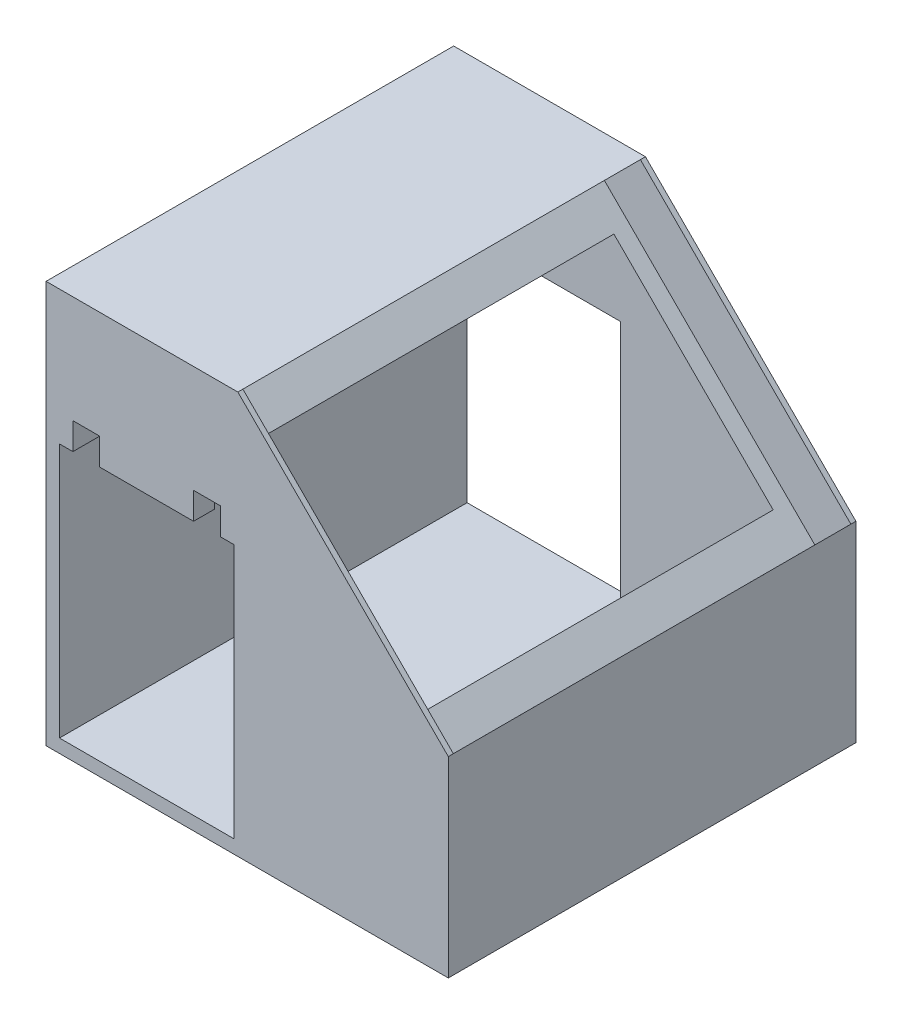
from build123d import *

# Parameters (mm, degrees)
SKETCH1_W           = 150
SKETCH1_H           = 150
SKETCH1_W_2         = 65
SKETCH1_H_2         = 95
BOSS_EXTRUDE2_DEPTH = 152
CHAMFER1_SIZE       = 78.48885271
SKETCH4_W           = 148.25
SKETCH4_H           = 111
CUT_EXTRUDE5_DEPTH  = 19
SKETCH5_W           = 136.25
SKETCH5_H           = 84
CUT_EXTRUDE6_DEPTH  = 81
SKETCH6_W           = 10
SKETCH6_H           = 10
CUT_EXTRUDE7_DEPTH  = 40
SKETCH7_W           = 10
SKETCH7_H           = 10
CUT_EXTRUDE8_DEPTH  = 40
SKETCH10_W          = 40
SKETCH10_H          = 6
CUT_EXTRUDE10_DEPTH = 10


with BuildPart() as part:
    # Sketch1 → Boss-Extrude2 (new body)
    with BuildSketch(Plane.XY):
        with Locations((75, 75)):
            Rectangle(SKETCH1_W, SKETCH1_H)
        with Locations((37.5, 52.5)):
            Rectangle(SKETCH1_W_2, SKETCH1_H_2, mode=Mode.SUBTRACT)
    extrude(amount=BOSS_EXTRUDE2_DEPTH)

    # Chamfer1
    chamfer1_edges = [part.edges().sort_by_distance(p)[0] for p in [
        (150, 150, 76),
    ]]
    chamfer(chamfer1_edges, length=CHAMFER1_SIZE)

    # Sketch4 → Cut-Extrude5 (cut)
    with BuildSketch(Plane(origin=(110.755573645, 110.755573645, 0), x_dir=(0, 0, -1), z_dir=(0.7071067811865489, 0.7071067811865461, 0))):
        with Locations((-76, 0.001948307)):
            Rectangle(SKETCH4_W, SKETCH4_H)
    extrude(amount=-CUT_EXTRUDE5_DEPTH, mode=Mode.SUBTRACT)

    # Sketch5 → Cut-Extrude6 (cut)
    with BuildSketch(Plane(origin=(97.320544802, 97.320544802, 0), x_dir=(0, 0, -1), z_dir=(0.707106781186549, 0.707106781186546, 0))):
        with Locations((-76, 0.001948307)):
            Rectangle(SKETCH5_W, SKETCH5_H)
    extrude(amount=-CUT_EXTRUDE6_DEPTH, mode=Mode.SUBTRACT)

    # Sketch6 → Cut-Extrude7 (cut)
    with BuildSketch(Plane.XY.offset(152)):
        with Locations((15, 105)):
            Rectangle(SKETCH6_W, SKETCH6_H)
    extrude(amount=-CUT_EXTRUDE7_DEPTH, mode=Mode.SUBTRACT)

    # Sketch7 → Cut-Extrude8 (cut)
    with BuildSketch(Plane.XY.offset(152)):
        with Locations((60, 105)):
            Rectangle(SKETCH7_W, SKETCH7_H)
    extrude(amount=-CUT_EXTRUDE8_DEPTH, mode=Mode.SUBTRACT)

    # Sketch10 → Cut-Extrude10 (cut)
    with BuildSketch(Plane.XZ.offset(-100)):
        with Locations((40, 115)):
            Rectangle(SKETCH10_W, SKETCH10_H)
    extrude(amount=-CUT_EXTRUDE10_DEPTH, mode=Mode.SUBTRACT)


solid = part.part
